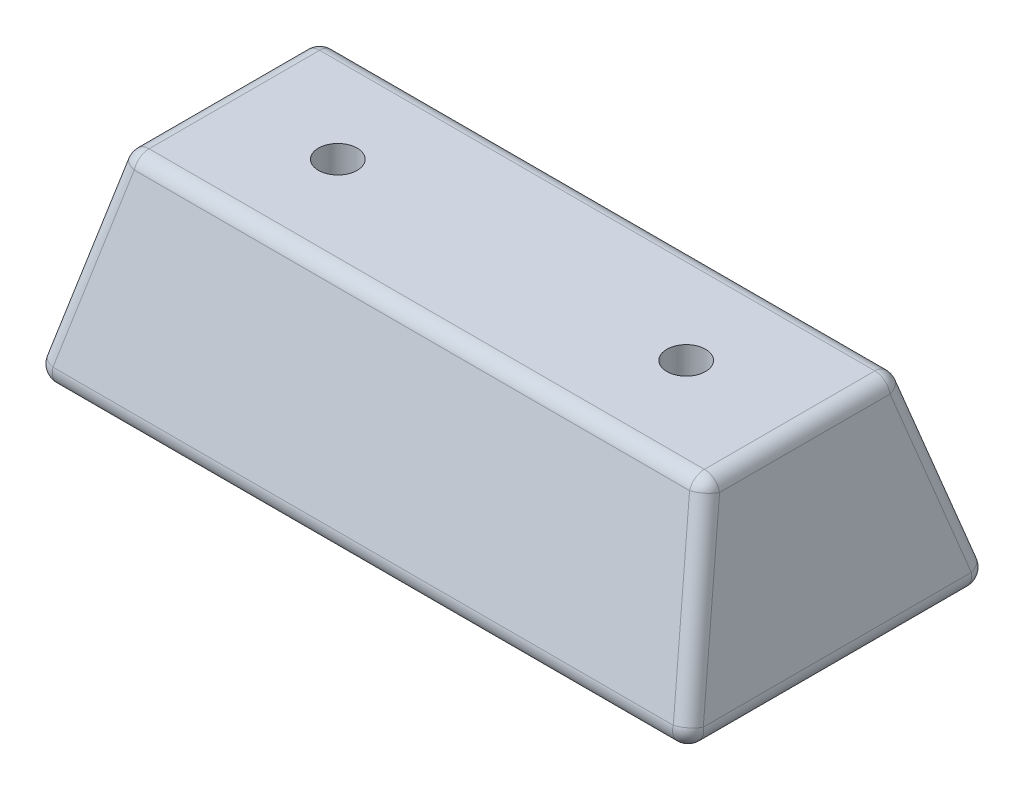
from build123d import *

# Parameters (mm, degrees)
SKETCH3_R          = 3.175
CUT_EXTRUDE1_DEPTH = 68.57605454
FILLET1_R          = 2.54


with BuildPart() as part:
    # Sketch1 → Loft1 section 0
    with BuildSketch(Plane(origin=(0, 0, 0), x_dir=(1, 0, 0), z_dir=(0, 1, 0))):
        with BuildLine():
            Line((-53.975, -25.4), (53.975, -25.4))
            Line((53.975, -25.4), (53.975, 25.4))
            Line((53.975, 25.4), (-53.975, 25.4))
            Line((-53.975, 25.4), (-53.975, -25.4))
        make_face()
    # Sketch2 → Loft1 section 1
    with BuildSketch(Plane(origin=(0, 31.75, 0), x_dir=(1, 0, 0), z_dir=(0, 1, 0))):
        with BuildLine():
            Line((-47.625, -15.875), (47.625, -15.875))
            Line((47.625, -15.875), (47.625, 15.875))
            Line((47.625, 15.875), (-47.625, 15.875))
            Line((-47.625, 15.875), (-47.625, -15.875))
        make_face()
    loft()

    # Sketch3 → Cut-Extrude1 (cut, through all)
    with BuildSketch(Plane(origin=(0, 31.75, 0), x_dir=(1, 0, 0), z_dir=(0, 1, 0))):
        with Locations(Location((-28.575, 0, 0), (0, 0, 270))):
            Circle(SKETCH3_R)
        with Locations(Location((28.575, 0, 0), (0, 0, 90))):
            Circle(SKETCH3_R)
    extrude(amount=-CUT_EXTRUDE1_DEPTH, mode=Mode.SUBTRACT)

    # Fillet1
    fillet1_edges = [part.edges().sort_by_distance(p)[0] for p in [
        (-53.975, 0, 0),
        (0, 31.75, 15.875),
        (-47.625, 31.75, 0),
        (0, 31.75, -15.875),
        (47.625, 31.75, 0),
        (0, 0, 25.4),
        (53.975, 0, 0),
        (-50.8, 15.875, -20.6375),
        (0, 0, -25.4),
        (50.8, 15.875, -20.6375),
        (-50.8, 15.875, 20.6375),
        (50.8, 15.875, 20.6375),
    ]]
    fillet(fillet1_edges, radius=FILLET1_R)


solid = part.part
